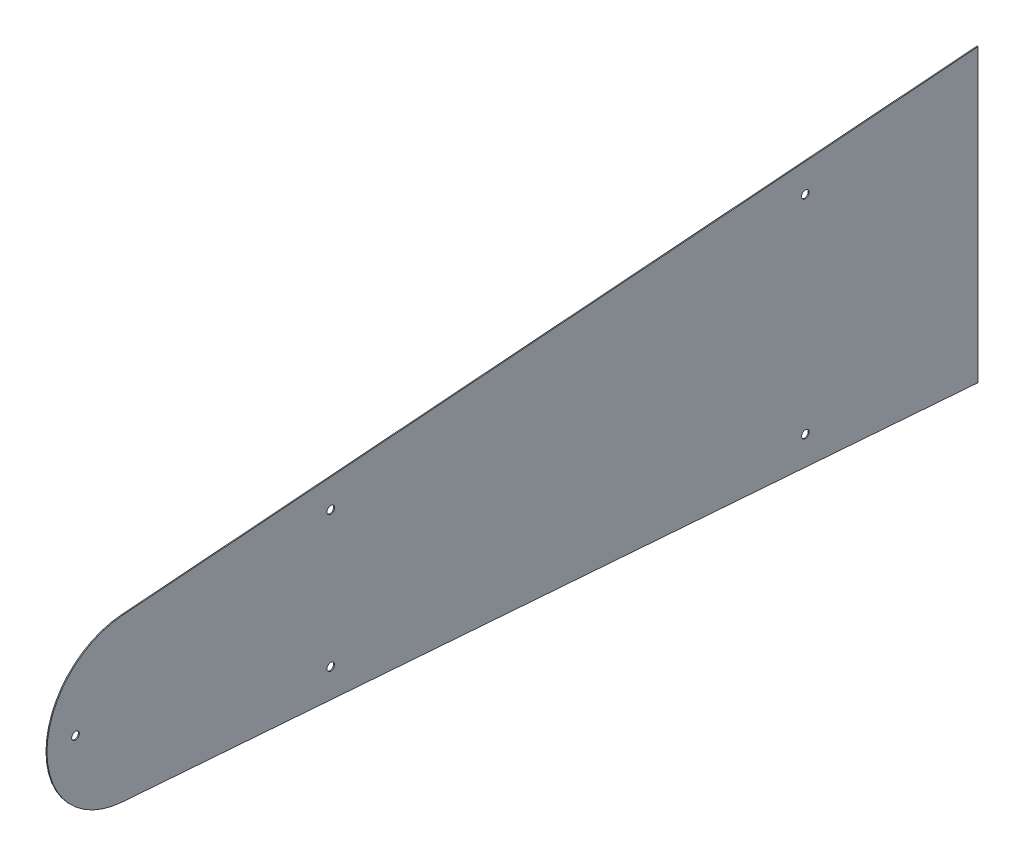
from build123d import *

# Parameters (mm, degrees)
BOSS_EXTRUDE1_DEPTH     = 0.5
CUT_EXTRUDE1_DEPTH      = 1006.633971904
CUT_EXTRUDE1_DEPTH_BACK = 1006.633971904
SKETCH2_R               = 4


with BuildPart() as part:
    # Sketch1 → Boss-Extrude1 (new, symmetric)
    with BuildSketch(Plane.YZ):
        with BuildLine():
            Line((-152.879110482, 15.875), (-84.862670824, 915.257797566))
            ThreePointArc((-84.862670824, 915.257797566), (0, 993.945), (84.862670824, 915.257797566))
            Line((84.862670824, 915.257797566), (152.879110482, 15.875))
            Line((152.879110482, 15.875), (-152.879110482, 15.875))
        make_face()
    extrude(amount=BOSS_EXTRUDE1_DEPTH, both=True)

    # Sketch2 → Cut-Extrude1 (cut, two sides: drawn at the far end of the back side and taken through both)
    with BuildSketch(Plane.YZ.offset(0.5).offset(-CUT_EXTRUDE1_DEPTH_BACK)):
        with Locations(Location((71.374429386, 695.789702433, 0), (0, 0, 270))):
            Circle(SKETCH2_R)
        with Locations(Location((109.079602796, 197.213409477, 0), (0, 0, 270))):
            Circle(SKETCH2_R)
        with Locations(Location((0, 963.945, 0), (0, 0, 270))):
            Circle(SKETCH2_R)
        with Locations(Location((-71.374429386, 695.789702433, 0), (0, 0, 270))):
            Circle(SKETCH2_R)
        with Locations(Location((-109.079602796, 197.213409477, 0), (0, 0, 270))):
            Circle(SKETCH2_R)
    extrude(amount=CUT_EXTRUDE1_DEPTH + CUT_EXTRUDE1_DEPTH_BACK, mode=Mode.SUBTRACT)


solid = part.part
